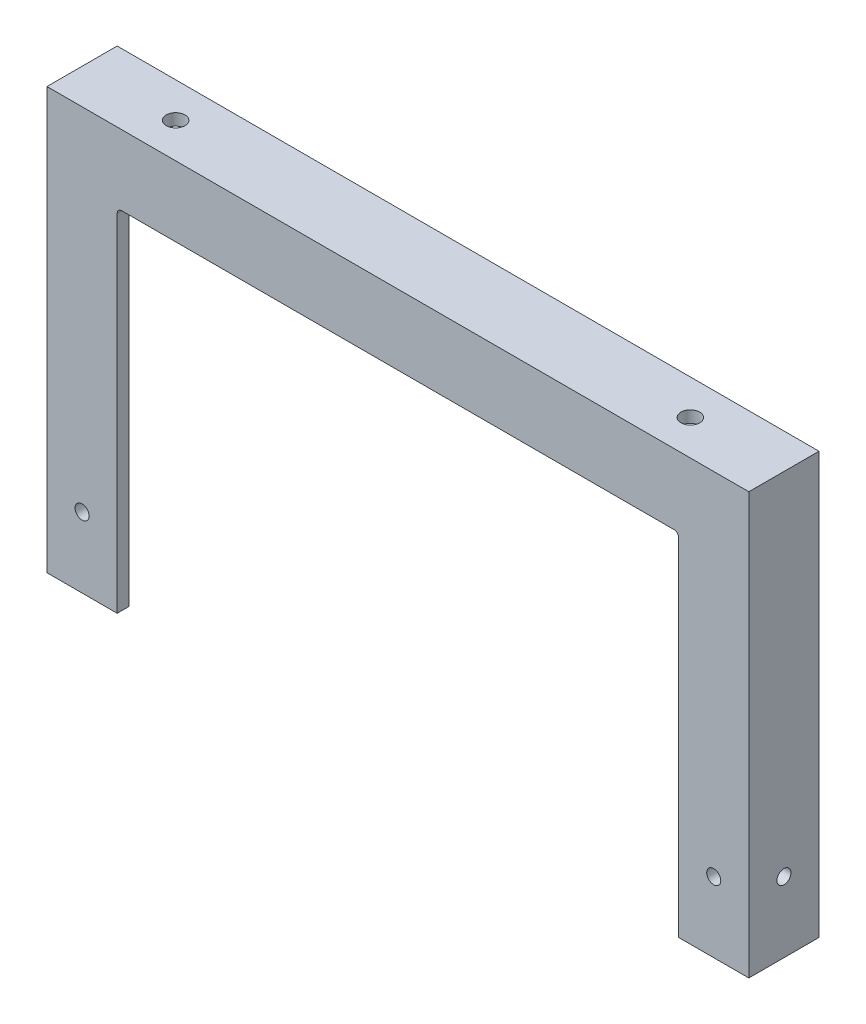
from build123d import *

# Parameters (mm, degrees)
BOSS_EXTRUDE1_DEPTH = 25
CUT_EXTRUDE2_DEPTH  = 20
SKETCH6_R           = 3
CUT_EXTRUDE5_DEPTH  = 400
BOSS_EXTRUDE2_DEPTH = 5
SKETCH8_R           = 3
CUT_EXTRUDE6_DEPTH  = 350
FILLET3_R           = 2
SKETCH9_R           = 4
CUT_EXTRUDE7_DEPTH  = 350


with BuildPart() as part:
    # Sketch1 → Boss-Extrude1 (new body)
    with BuildSketch(Plane.XY):
        Polygon((0, 0), (0, 180), (300, 180), (300, 0), (270, 0), (270, 150), (30, 150), (30, 0), align=None)
    extrude(amount=BOSS_EXTRUDE1_DEPTH)

    # Sketch3 → Cut-Extrude2 (cut)
    with BuildSketch(Plane(origin=(0, 0, 0), x_dir=(-1, 0, 0), z_dir=(0, 0, -1))):
        Polygon((-5, 0), (-30, 0), (-30, 150), (-270, 150), (-270, 0), (-295, 0), (-295, 175), (-5, 175), align=None)
    extrude(amount=-CUT_EXTRUDE2_DEPTH, mode=Mode.SUBTRACT)

    # Sketch6 → Cut-Extrude5 (cut)
    with BuildSketch(Plane.XY.offset(25)):
        with Locations((15, 30)):
            Circle(SKETCH6_R)
        with Locations((285, 30)):
            Circle(SKETCH6_R)
    extrude(amount=-CUT_EXTRUDE5_DEPTH, mode=Mode.SUBTRACT)

    # Sketch7 → Boss-Extrude2 (add)
    with BuildSketch(Plane(origin=(0, 0, 0), x_dir=(-1, 0, 0), z_dir=(0, 0, -1))):
        Polygon((-300, 0), (-300, 180), (0, 180), (0, 0), (-5, 0), (-5, 175), (-295, 175), (-295, 0), align=None)
    extrude(amount=BOSS_EXTRUDE2_DEPTH)

    # Sketch8 → Cut-Extrude6 (cut)
    with BuildSketch(Plane.ZY):
        with Locations((10, 30)):
            Circle(SKETCH8_R)
    extrude(amount=-CUT_EXTRUDE6_DEPTH, mode=Mode.SUBTRACT)

    # Fillet3
    fillet3_edges = [part.edges().sort_by_distance(p)[0] for p in [
        (270, 150, 22.5),
        (30, 150, 22.5),
        (5, 87.5, 20),
        (5, 175, 7.5),
        (295, 87.5, 20),
        (150, 175, 20),
        (295, 175, 7.5),
    ]]
    fillet(fillet3_edges, radius=FILLET3_R)

    # Sketch9 → Cut-Extrude7 (cut)
    with BuildSketch(Plane(origin=(0, 180, 0), x_dir=(1, 0, 0), z_dir=(0, 1, 0))):
        with Locations(Location((40, -10, 0), (0, 0, 270))):
            Circle(SKETCH9_R)
        with Locations(Location((260, -10, 0), (0, 0, 270))):
            Circle(SKETCH9_R)
    extrude(amount=-CUT_EXTRUDE7_DEPTH, mode=Mode.SUBTRACT)


solid = part.part
